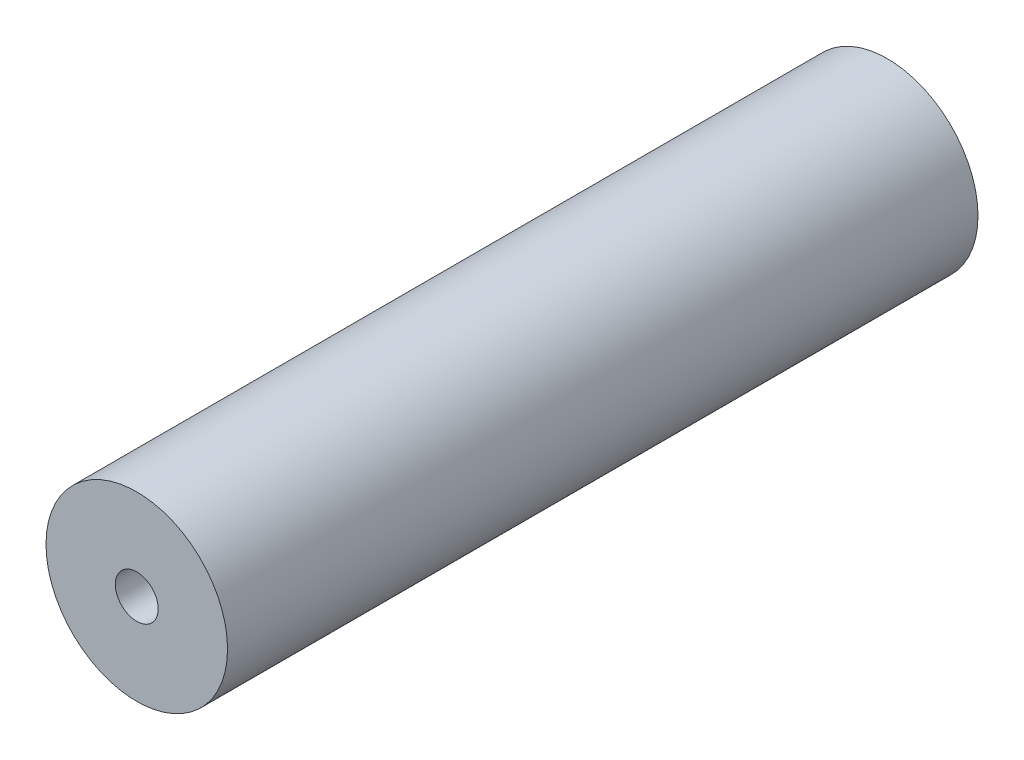
from build123d import *

# Parameters (mm, degrees)
SKETCH2_R           = 12.7
BOSS_EXTRUDE1_DEPTH = 52.5
CUT_EXTRUDE1_REACH  = 142.64
SKETCH3_R           = 3
SKETCH4_R           = 8.5
CUT_EXTRUDE2_DEPTH  = 1.275
SKETCH5_R           = 7.5
CUT_EXTRUDE3_DEPTH  = 5


with BuildPart() as part:
    # Sketch2 → Boss-Extrude1 (new, symmetric)
    with BuildSketch(Plane.XY):
        with Locations((-80, 0)):
            Circle(SKETCH2_R)
    extrude(amount=BOSS_EXTRUDE1_DEPTH, both=True)

    # Sketch3 → Cut-Extrude1 (cut, up to next)
    with BuildSketch(Plane(origin=(0, 0, -52.5), x_dir=(-1, 0, 0), z_dir=(0, 0, -1)), mode=Mode.PRIVATE) as cut_extrude1_sk1:
        with Locations((80, 0)):
            Circle(SKETCH3_R)
    cut_extrude1_tool1 = extrude(cut_extrude1_sk1.sketch, amount=-CUT_EXTRUDE1_REACH, mode=Mode.PRIVATE) & part.part
    add(cut_extrude1_tool1.solids().sort_by_distance((-80, 0, -52.5))[0], mode=Mode.SUBTRACT)

    # Sketch4 → Cut-Extrude2 (cut)
    with BuildSketch(Plane(origin=(0, 0, -52.5), x_dir=(-1, 0, 0), z_dir=(0, 0, -1))):
        with Locations((80, 0)):
            Circle(SKETCH4_R)
    extrude(amount=-CUT_EXTRUDE2_DEPTH, mode=Mode.SUBTRACT)

    # Sketch5 → Cut-Extrude3 (cut)
    with BuildSketch(Plane(origin=(0, 0, -52.5), x_dir=(-1, 0, 0), z_dir=(0, 0, -1))):
        with Locations((80, 0)):
            Circle(SKETCH5_R)
    extrude(amount=-CUT_EXTRUDE3_DEPTH, mode=Mode.SUBTRACT)


solid = part.part
